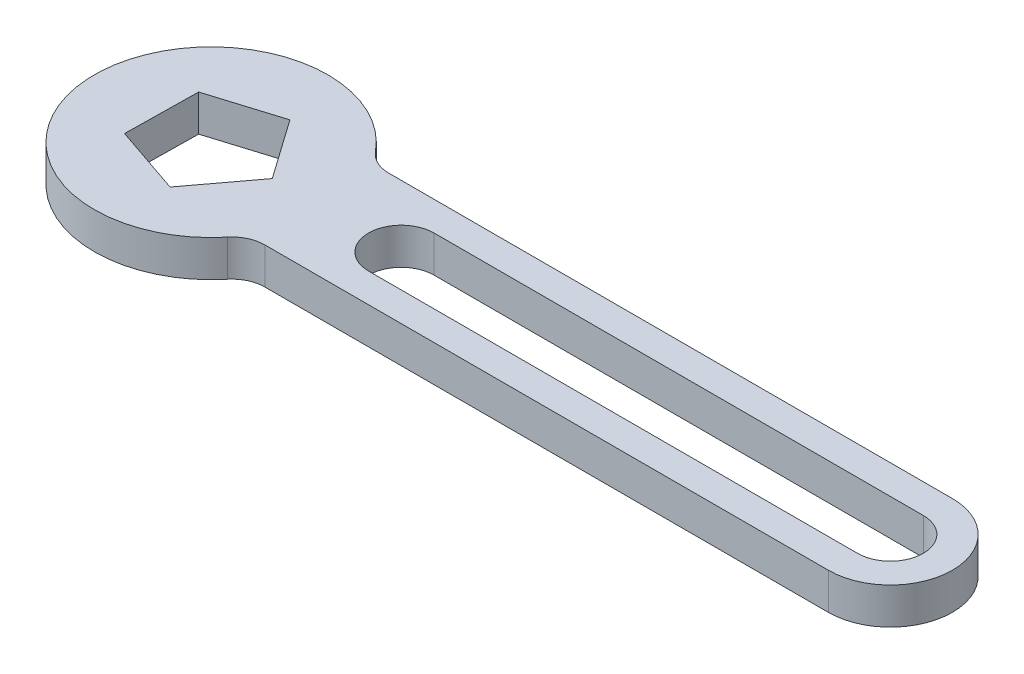
from build123d import *

# Parameters (mm, degrees)
SKETCH1_R           = 32
BOSS_EXTRUDE1_DEPTH = 10


with BuildPart() as part:
    # Sketch1 → Boss-Extrude1 (new body)
    # profile 1 of 2: a face of its own
    with BuildSketch(Plane(origin=(0, 0, 0), x_dir=(1, 0, 0), z_dir=(0, 1, 0))):
        with Locations((-186.104281586, 0)):
            Circle(SKETCH1_R)
        Polygon((-169.093123496, -0.251434953), (-180.608415791, 16.100875078), (-199.718807817, 10.202323), (-200.014387332, -9.7954927), (-181.086673492, -16.256270425), align=None, mode=Mode.SUBTRACT)
    # profile 2 of 2: a face of its own
    with BuildSketch(Plane(origin=(0, 0, 0), x_dir=(1, 0, 0), z_dir=(0, 1, 0))):
        with BuildLine():
            Line((0, 17), (-134, 17))
            Line((-134, 17), (-154.402546617, 17))
            ThreePointArc((-154.402546617, 17), (-158.25184177, 17.864711017), (-161.361464049, 20.292682927))
            ThreePointArc((-161.361464049, 20.292682927), (-155.973150167, 10.775663294), (-154.104281586, 0))
            ThreePointArc((-154.104281586, 0), (-155.973150167, -10.775663294), (-161.361464049, -20.292682927))
            ThreePointArc((-161.361464049, -20.292682927), (-158.25184177, -17.864711017), (-154.402546617, -17))
            Line((-154.402546617, -17), (-134, -17))
            Line((-134, -17), (0, -17))
            ThreePointArc((0, -17), (17, 0), (0, 17))
        make_face()
        with BuildLine():
            ThreePointArc((-134, -9), (-143, 0), (-134, 9))
            Line((-134, 9), (0, 9))
            ThreePointArc((0, 9), (9, 0), (0, -9))
            Line((0, -9), (-134, -9))
        make_face(mode=Mode.SUBTRACT)
    extrude(amount=BOSS_EXTRUDE1_DEPTH)


solid = part.part
